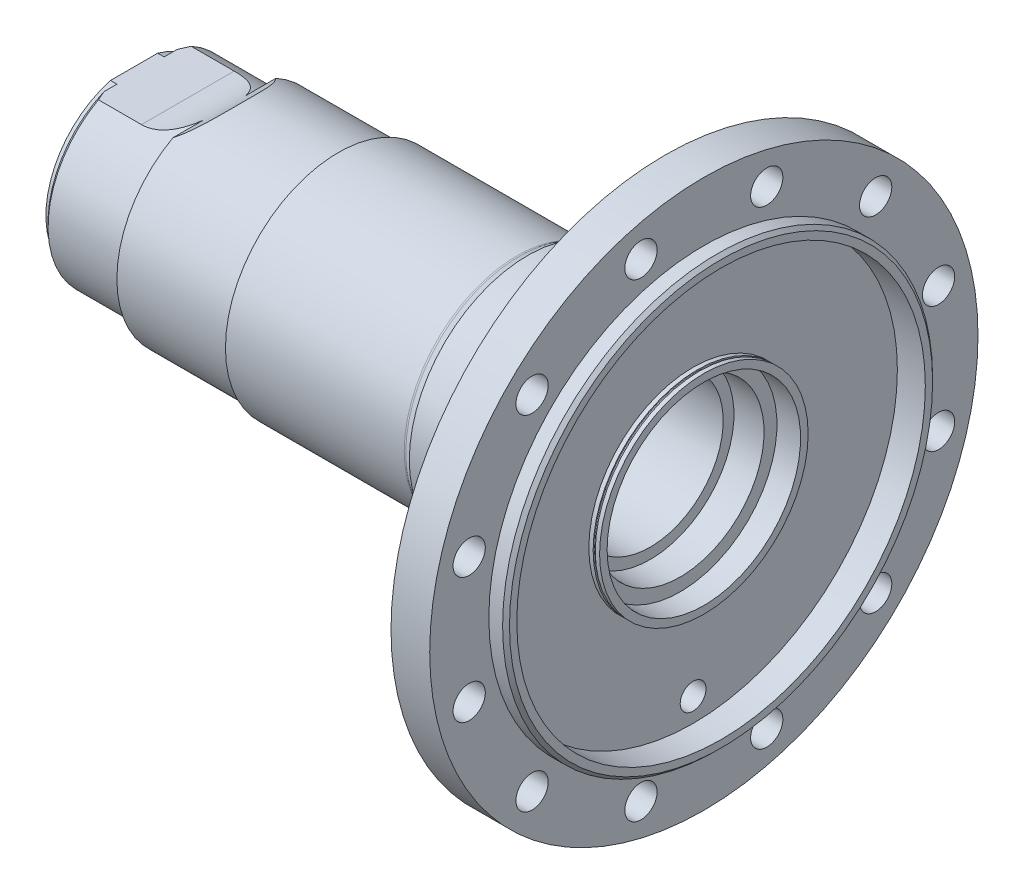
from build123d import *

# Parameters (mm, degrees)
SKETCH_3_W                    = 2
SKETCH_3_H                    = 46.5
SKETCH_5_W                    = 2
SKETCH_5_H                    = 46.5
SKETCH_6_R                    = 7.5
CUT_EXTRUDE_1_DEPTH           = 328.171973127
SKETCH_7_R                    = 7.5
CUT_EXTRUDE_2_DEPTH           = 328.171973127
SKETCH_8_R                    = 7.5
CUT_EXTRUDE_3_DEPTH           = 328.171973127
SKETCH_9_R                    = 7.5
CUT_EXTRUDE_4_DEPTH           = 328.171973127
SKETCH_10_R                   = 7.5
CUT_EXTRUDE_5_DEPTH           = 328.171973127
SKETCH_11_R                   = 7.5
CUT_EXTRUDE_6_DEPTH           = 328.171973127
SKETCH_12_R                   = 7.5
CUT_EXTRUDE_7_DEPTH           = 328.171973127
SKETCH_13_R                   = 7.5
CUT_EXTRUDE_8_DEPTH           = 328.171973127
SKETCH_14_R                   = 7.5
CUT_EXTRUDE_9_DEPTH           = 328.171973127
SKETCH_15_R                   = 7.5
CUT_EXTRUDE_10_DEPTH          = 328.171973127
SKETCH_16_R                   = 7.5
CUT_EXTRUDE_11_DEPTH          = 328.171973127
SKETCH_17_R                   = 7.5
CUT_EXTRUDE_12_DEPTH          = 328.171973127
SKETCH_18_R                   = 6
CUT_EXTRUDE_13_DEPTH          = 328.171973127
LEFT_FLAT_84_5_R35_DEPTH      = 328.171973127
LEFT_FLAT_84_5_R35_DEPTH_BACK = 328.171973127
LEFT_END_BOTTOM_20_DEPTH      = 328.171973127
LEFT_END_BOTTOM_20_DEPTH_BACK = 328.171973127
SKETCH_20_W                   = 4
SKETCH_20_H                   = 75


with BuildPart() as part:
    # Эскиз1 → Повернуть1 (revolve)
    with BuildSketch(Plane.XY, mode=Mode.PRIVATE) as revolve_1_sk:
        with BuildLine():
            Line((0, 0), (273, 0))
            Line((273, 0), (273, 98.4))
            Line((273, 98.4), (271.4, 100))
            Line((271.4, 100), (265, 100))
            Line((265, 100), (265, 127.5))
            Line((265, 127.5), (247, 127.5))
            Line((247, 127.5), (247, 94.828427125))
            ThreePointArc((247, 94.828427125), (246.847759065, 94.06306026), (246.414213562, 93.414213562))
            Line((246.414213562, 93.414213562), (245, 92))
            Line((245, 92), (245, 82.828427125))
            ThreePointArc((245, 82.828427125), (244.847759065, 82.06306026), (244.414213562, 81.414213562))
            Line((244.414213562, 81.414213562), (241, 78))
            Line((241, 78), (241, 68.328427125))
            ThreePointArc((241, 68.328427125), (240.847759065, 67.56306026), (240.414213562, 66.914213562))
            Line((240.414213562, 66.914213562), (239, 65.5))
            Line((239, 65.5), (239, 64.5))
            ThreePointArc((239, 64.5), (238.414213562, 63.085786438), (237, 62.5))
            Line((237, 62.5), (218, 62.5))
            Line((218, 62.5), (215, 60.767949192))
            Line((215, 60.767949192), (215, 57))
            ThreePointArc((215, 57), (214.414213562, 55.585786438), (213, 55))
            Line((213, 55), (183, 55))
            Line((183, 55), (179.133974596, 52.767949192))
            ThreePointArc((179.133974596, 52.767949192), (178.651612686, 52.568148347), (178.133974596, 52.5))
            Line((178.133974596, 52.5), (95, 52.5))
            Line((95, 52.5), (95, 50))
            Line((95, 50), (42, 50))
            Line((42, 50), (42, 45))
            Line((42, 45), (5, 45))
            Line((5, 45), (3, 43))
            Line((3, 43), (3, 41))
            Line((3, 41), (0, 41))
            Line((0, 41), (0, 0))
        make_face()
    revolve(revolve_1_sk.sketch.rotate(Axis((0, 0, 0), (1, 0, 0)), 90), axis=Axis((0, 0, 0), (1, 0, 0)))

    # Эскиз2 → Вырез-Повернуть1 (revolve, cut)
    with BuildSketch(Plane.XY, mode=Mode.PRIVATE) as cut_revolve_1_sk:
        Polygon((0, 0), (273, 0), (273, 95), (265, 95), (265, 45), (254, 45), (254, 39), (240, 39), (240, 34), (203.5, 34), (203.5, 31), (3, 31), (0, 32.732050808), align=None)
    revolve(cut_revolve_1_sk.sketch.rotate(Axis((0, 0, 0), (1, 0, 0)), 90), axis=Axis((0, 0, 0), (1, 0, 0)), mode=Mode.SUBTRACT)

    # Эскиз3 → Rear_recess_left (revolve, cut)
    with BuildSketch(Plane.XY, mode=Mode.PRIVATE) as rear_recess_left_sk:
        with Locations((261, 71.75)):
            Rectangle(SKETCH_3_W, SKETCH_3_H)
    revolve(rear_recess_left_sk.sketch.rotate(Axis((0, 0, 0), (1, 0, 0)), 90), axis=Axis((0, 0, 0), (1, 0, 0)), mode=Mode.SUBTRACT)

    # Эскиз4 → Collar_groove_nominal (revolve, cut)
    with BuildSketch(Plane.XY, mode=Mode.PRIVATE) as collar_groove_nominal_sk:
        with BuildLine():
            Line((263, 48), (263, 95))
            Line((263, 95), (262, 95))
            Line((262, 95), (262, 48))
            ThreePointArc((262, 48), (262.146446609, 47.646446609), (262.5, 47.5))
            ThreePointArc((262.5, 47.5), (262.853553391, 47.646446609), (263, 48))
        make_face()
    revolve(collar_groove_nominal_sk.sketch.rotate(Axis((0, 0, 0), (1, 0, 0)), 90), axis=Axis((0, 0, 0), (1, 0, 0)), mode=Mode.SUBTRACT)

    # Эскиз5 → Rear_recess_lip (revolve, cut)
    with BuildSketch(Plane.XY, mode=Mode.PRIVATE) as rear_recess_lip_sk:
        with Locations((264, 71.75)):
            Rectangle(SKETCH_5_W, SKETCH_5_H)
    revolve(rear_recess_lip_sk.sketch.rotate(Axis((0, 0, 0), (1, 0, 0)), 90), axis=Axis((0, 0, 0), (1, 0, 0)), mode=Mode.SUBTRACT)

    # Эскиз6 → Вырез-Вытянуть1 (cut, through all)
    with BuildSketch(Plane(origin=(0, 0, 0), x_dir=(0, 0, -1), z_dir=(1, 0, 0))):
        with Locations(Location((109.149618371, 29.246552097, 0), (0, 0, 180))):
            Circle(SKETCH_6_R)
    extrude(amount=CUT_EXTRUDE_1_DEPTH, mode=Mode.SUBTRACT)

    # Эскиз7 → Вырез-Вытянуть2 (cut, through all)
    with BuildSketch(Plane(origin=(0, 0, 0), x_dir=(0, 0, -1), z_dir=(1, 0, 0))):
        with Locations(Location((79.903066274, 79.903066274, 0), (0, 0, 180))):
            Circle(SKETCH_7_R)
    extrude(amount=CUT_EXTRUDE_2_DEPTH, mode=Mode.SUBTRACT)

    # Эскиз8 → Вырез-Вытянуть3 (cut, through all)
    with BuildSketch(Plane(origin=(0, 0, 0), x_dir=(0, 0, -1), z_dir=(1, 0, 0))):
        with Locations(Location((29.246552097, 109.149618371, 0), (0, 0, 180))):
            Circle(SKETCH_8_R)
    extrude(amount=CUT_EXTRUDE_3_DEPTH, mode=Mode.SUBTRACT)

    # Эскиз9 → Вырез-Вытянуть4 (cut, through all)
    with BuildSketch(Plane(origin=(0, 0, 0), x_dir=(0, 0, -1), z_dir=(1, 0, 0))):
        with Locations(Location((-29.246552097, 109.149618371, 0), (0, 0, 180))):
            Circle(SKETCH_9_R)
    extrude(amount=CUT_EXTRUDE_4_DEPTH, mode=Mode.SUBTRACT)

    # Эскиз10 → Вырез-Вытянуть5 (cut, through all)
    with BuildSketch(Plane(origin=(0, 0, 0), x_dir=(0, 0, -1), z_dir=(1, 0, 0))):
        with Locations(Location((-79.903066274, 79.903066274, 0), (0, 0, 180))):
            Circle(SKETCH_10_R)
    extrude(amount=CUT_EXTRUDE_5_DEPTH, mode=Mode.SUBTRACT)

    # Эскиз11 → Вырез-Вытянуть6 (cut, through all)
    with BuildSketch(Plane(origin=(0, 0, 0), x_dir=(0, 0, -1), z_dir=(1, 0, 0))):
        with Locations(Location((-109.149618371, 29.246552097, 0), (0, 0, 180))):
            Circle(SKETCH_11_R)
    extrude(amount=CUT_EXTRUDE_6_DEPTH, mode=Mode.SUBTRACT)

    # Эскиз12 → Вырез-Вытянуть7 (cut, through all)
    with BuildSketch(Plane(origin=(0, 0, 0), x_dir=(0, 0, -1), z_dir=(1, 0, 0))):
        with Locations(Location((-109.149618371, -29.246552097, 0), (0, 0, 180))):
            Circle(SKETCH_12_R)
    extrude(amount=CUT_EXTRUDE_7_DEPTH, mode=Mode.SUBTRACT)

    # Эскиз13 → Вырез-Вытянуть8 (cut, through all)
    with BuildSketch(Plane(origin=(0, 0, 0), x_dir=(0, 0, -1), z_dir=(1, 0, 0))):
        with Locations(Location((-79.903066274, -79.903066274, 0), (0, 0, 180))):
            Circle(SKETCH_13_R)
    extrude(amount=CUT_EXTRUDE_8_DEPTH, mode=Mode.SUBTRACT)

    # Эскиз14 → Вырез-Вытянуть9 (cut, through all)
    with BuildSketch(Plane(origin=(0, 0, 0), x_dir=(0, 0, -1), z_dir=(1, 0, 0))):
        with Locations(Location((-29.246552097, -109.149618371, 0), (0, 0, 180))):
            Circle(SKETCH_14_R)
    extrude(amount=CUT_EXTRUDE_9_DEPTH, mode=Mode.SUBTRACT)

    # Эскиз15 → Вырез-Вытянуть10 (cut, through all)
    with BuildSketch(Plane(origin=(0, 0, 0), x_dir=(0, 0, -1), z_dir=(1, 0, 0))):
        with Locations(Location((29.246552097, -109.149618371, 0), (0, 0, 180))):
            Circle(SKETCH_15_R)
    extrude(amount=CUT_EXTRUDE_10_DEPTH, mode=Mode.SUBTRACT)

    # Эскиз16 → Вырез-Вытянуть11 (cut, through all)
    with BuildSketch(Plane(origin=(0, 0, 0), x_dir=(0, 0, -1), z_dir=(1, 0, 0))):
        with Locations(Location((79.903066274, -79.903066274, 0), (0, 0, 180))):
            Circle(SKETCH_16_R)
    extrude(amount=CUT_EXTRUDE_11_DEPTH, mode=Mode.SUBTRACT)

    # Эскиз17 → Вырез-Вытянуть12 (cut, through all)
    with BuildSketch(Plane(origin=(0, 0, 0), x_dir=(0, 0, -1), z_dir=(1, 0, 0))):
        with Locations(Location((109.149618371, -29.246552097, 0), (0, 0, 180))):
            Circle(SKETCH_17_R)
    extrude(amount=CUT_EXTRUDE_12_DEPTH, mode=Mode.SUBTRACT)

    # Эскиз18 → Вырез-Вытянуть13 (cut, through all)
    with BuildSketch(Plane(origin=(0, 0, 0), x_dir=(0, 0, -1), z_dir=(1, 0, 0))):
        with Locations(Location((0, -84, 0), (0, 0, 166.725608927))):
            Circle(SKETCH_18_R)
    extrude(amount=CUT_EXTRUDE_13_DEPTH, mode=Mode.SUBTRACT)

    # Эскиз19 → Left_flat_84_5_R35 (cut, two sides: drawn at the far end of the back side and taken through both)
    with BuildSketch(Plane.XY.offset(-LEFT_FLAT_84_5_R35_DEPTH_BACK)):
        with BuildLine():
            Line((-1, 39.5), (25, 39.5))
            ThreePointArc((25, 39.5), (49.748737342, 49.751262658), (60, 74.5))
            Line((60, 74.5), (60, 150))
            Line((60, 150), (-1, 150))
            Line((-1, 150), (-1, 39.5))
        make_face()
    extrude(amount=LEFT_FLAT_84_5_R35_DEPTH + LEFT_FLAT_84_5_R35_DEPTH_BACK, mode=Mode.SUBTRACT)

    # Эскиз20 → Left_end_bottom_20 (cut, two sides: drawn at the far end of the back side and taken through both)
    with BuildSketch(Plane.XY.offset(-LEFT_END_BOTTOM_20_DEPTH_BACK)):
        with Locations((1, -62.5)):
            Rectangle(SKETCH_20_W, SKETCH_20_H)
    extrude(amount=LEFT_END_BOTTOM_20_DEPTH + LEFT_END_BOTTOM_20_DEPTH_BACK, mode=Mode.SUBTRACT)


solid = part.part
